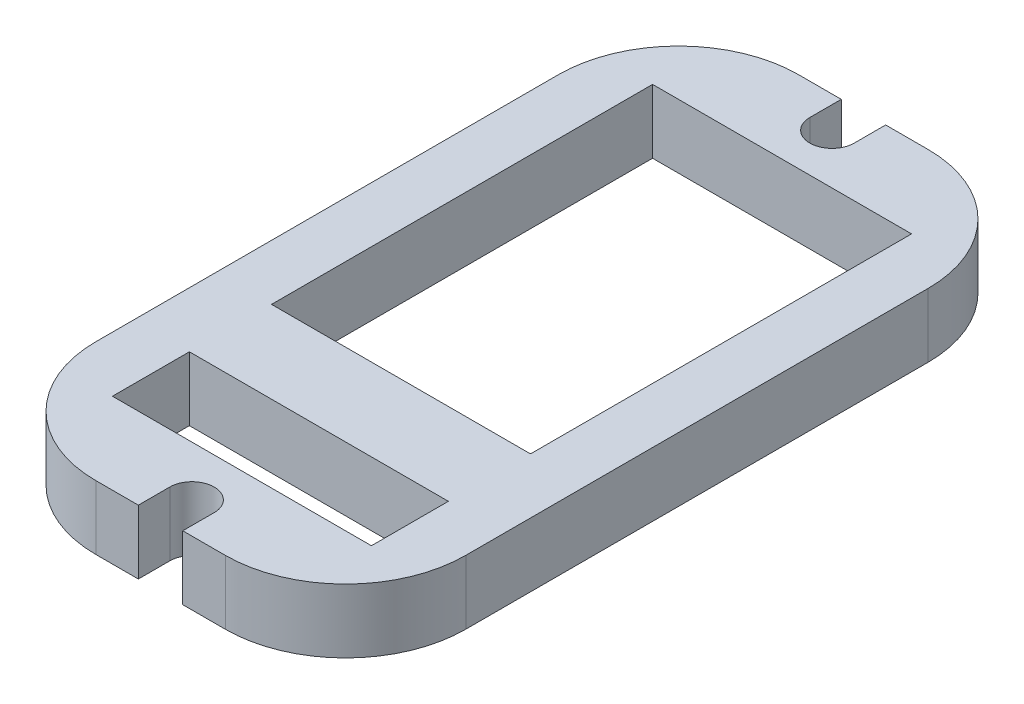
from build123d import *

# Parameters (mm, degrees)
SKETCH2_W           = 7
SKETCH2_H           = 10.3
SKETCH2_H_2         = 2.08
BOSS_EXTRUDE1_DEPTH = 1.73


with BuildPart() as part:
    # Sketch2 → Boss-Extrude1 (new body)
    with BuildSketch(Plane(origin=(0, 0, 0), x_dir=(1, 0, 0), z_dir=(0, 1, 0))):
        with BuildLine():
            Line((-0.6, 9.5), (-1.75, 9.5))
            ThreePointArc((-1.75, 9.5), (-4.048097039, 8.548097039), (-5, 6.25))
            Line((-5, 6.25), (-5, -6.25))
            ThreePointArc((-5, -6.25), (-4.048097039, -8.548097039), (-1.75, -9.5))
            Line((-1.75, -9.5), (-0.6, -9.5))
            Line((-0.6, -9.5), (-0.6, -8.65))
            ThreePointArc((-0.6, -8.65), (0, -8.05), (0.6, -8.65))
            Line((0.6, -8.65), (0.6, -9.5))
            Line((0.6, -9.5), (1.75, -9.5))
            ThreePointArc((1.75, -9.5), (4.048097039, -8.548097039), (5, -6.25))
            Line((5, -6.25), (5, 6.25))
            ThreePointArc((5, 6.25), (4.048097039, 8.548097039), (1.75, 9.5))
            Line((1.75, 9.5), (0.6, 9.5))
            Line((0.6, 9.5), (0.6, 8.65))
            ThreePointArc((0.6, 8.65), (0, 8.05), (-0.6, 8.65))
            Line((-0.6, 8.65), (-0.6, 9.5))
        make_face()
        with Locations((0, 2.15)):
            Rectangle(SKETCH2_W, SKETCH2_H, mode=Mode.SUBTRACT)
        with Locations((0, -6.26)):
            Rectangle(SKETCH2_W, SKETCH2_H_2, mode=Mode.SUBTRACT)
    extrude(amount=BOSS_EXTRUDE1_DEPTH)


solid = part.part
